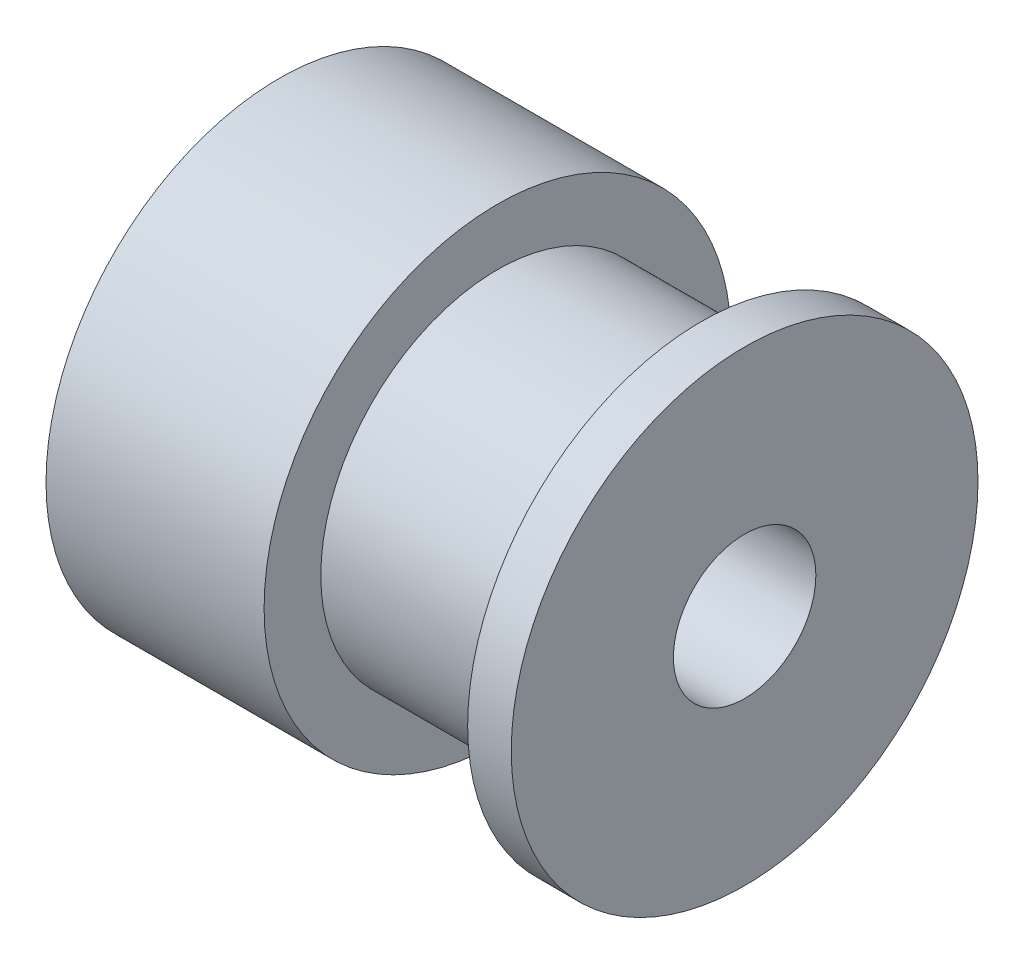
from build123d import *

# Parameters (mm, degrees)
SKETCH1_R           = 8.025
SKETCH1_R_2         = 2.45
BOSS_EXTRUDE1_DEPTH = 16
SKETCH3_W           = 7
SKETCH3_H           = 1.95


with BuildPart() as part:
    # Sketch1 → Boss-Extrude1 (new body)
    with BuildSketch(Plane(origin=(0, 0, 0), x_dir=(0, 0, -1), z_dir=(1, 0, 0))):
        Circle(SKETCH1_R)
        Circle(SKETCH1_R_2, mode=Mode.SUBTRACT)
    extrude(amount=BOSS_EXTRUDE1_DEPTH)

    # Sketch3 → Cut-Revolve1 (revolve, cut)
    with BuildSketch(Plane.XY, mode=Mode.PRIVATE) as cut_revolve1_sk:
        with Locations((11, 7.05)):
            Rectangle(SKETCH3_W, SKETCH3_H)
    revolve(cut_revolve1_sk.sketch.rotate(Axis((-1.784254148, 0, 0), (1, 0, 0)), 90), axis=Axis((-1.784254148, 0, 0), (1, 0, 0)), mode=Mode.SUBTRACT)


solid = part.part
